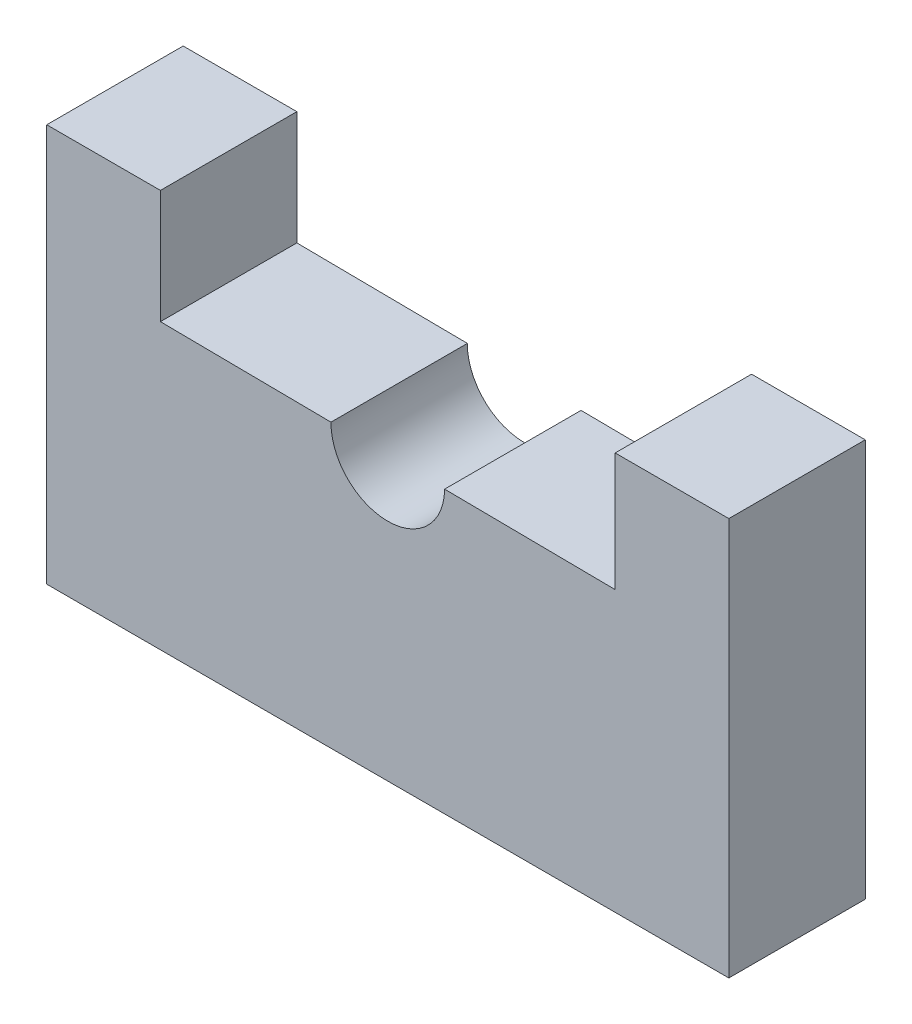
from build123d import *

# Parameters (mm, degrees)
BOSS_EXTRUDE1_DEPTH = 6


with BuildPart() as part:
    # Sketch1 → Boss-Extrude1 (new, symmetric)
    with BuildSketch(Plane.XY):
        with BuildLine():
            Line((24.157706093, 16.904121864), (34.157706093, 16.904121864))
            Line((34.157706093, 16.904121864), (34.157706093, -18.095878136))
            Line((34.157706093, -18.095878136), (-25.842293907, -18.095878136))
            Line((-25.842293907, -18.095878136), (-25.842293907, 16.904121864))
            Line((-25.842293907, 16.904121864), (-15.842293907, 16.904121864))
            Line((-15.842293907, 16.904121864), (-15.842293907, 6.904121864))
            Line((-15.842293907, 6.904121864), (-0.842028463, 6.749549236))
            ThreePointArc((-0.842028463, 6.749549236), (4.106185531, 1.698294118), (9.157440649, 6.646508112))
            Line((9.157440649, 6.646508112), (24.157706093, 6.491935484))
            Line((24.157706093, 6.491935484), (24.157706093, 11.07078853))
            Line((24.157706093, 11.07078853), (24.157706093, 16.904121864))
        make_face()
    extrude(amount=BOSS_EXTRUDE1_DEPTH, both=True)


solid = part.part
